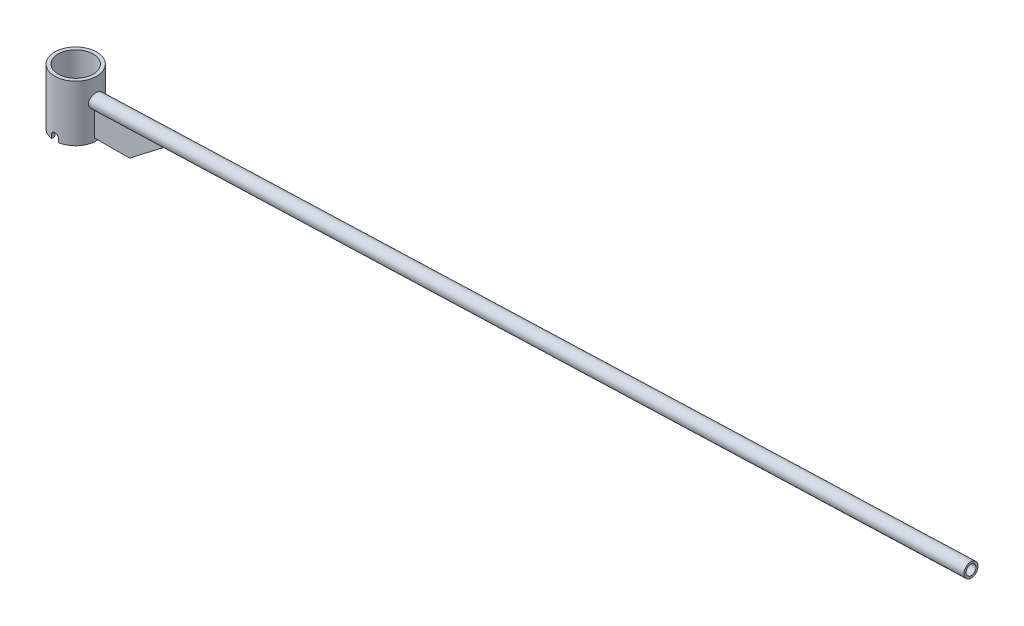
from build123d import *

# Parameters (mm, degrees)
SKETCH_1_R               = 30
SKETCH_1_R_2             = 25
EXTRUDE_1_DEPTH          = 40
EXTRUDE_2_REACH          = 1315.686
EXTRUDE_2_END_RADIUS     = 30
SKETCH_3_R               = 10
SKETCH_3_R_2             = 7
EXTRUDE_3_DEPTH          = 3
CUT_EXTRUDE_1_DEPTH      = 1283.280865753
CUT_EXTRUDE_1_DEPTH_BACK = 1283.280865753


with BuildPart() as part:
    # Эскиз1 → Бобышка-Вытянуть1 (new, symmetric)
    with BuildSketch(Plane(origin=(0, 0, 0), x_dir=(1, 0, 0), z_dir=(0, 1, 0))):
        with Locations(Location((0, 0, 0), (0, 0, 270))):
            Circle(SKETCH_1_R)
        with Locations(Location((0, 0, 0), (0, 0, 270))):
            Circle(SKETCH_1_R_2, mode=Mode.SUBTRACT)
    extrude(amount=EXTRUDE_1_DEPTH, both=True)

    # Эскиз5 → Вырез-Вытянуть1 (cut, two sides: drawn at the far end of the back side and taken through both)
    with BuildSketch(Plane.XY.offset(-CUT_EXTRUDE_1_DEPTH_BACK)):
        with BuildLine():
            Line((-5, -35), (-5, -62))
            Line((-5, -62), (5, -62))
            Line((5, -62), (5, -35))
            ThreePointArc((5, -35), (0, -30), (-5, -35))
        make_face()
    extrude(amount=CUT_EXTRUDE_1_DEPTH + CUT_EXTRUDE_1_DEPTH_BACK, mode=Mode.SUBTRACT)


with BuildPart() as body_2:
    # Бобышка-Вытянуть2: up to this cylinder (the profile starts outside it)
    extrude_2_end = Plane(origin=(0, 43.939724, 0), z_dir=(0, -1, 0)) * Cylinder(EXTRUDE_2_END_RADIUS, 2692.372, mode=Mode.PRIVATE)
    # Эскиз3 → Бобышка-Вытянуть2 (new, up to the surface)
    with BuildSketch(Plane(origin=(1280, 53.650961865, 0), x_dir=(0, 0, -1), z_dir=(0.999390827019096, 0.03489949670249754, 0)), mode=Mode.PRIVATE) as extrude_2_sk1:
        with Locations(Location((0, 0, 0), (0, 0, 90))):
            Circle(SKETCH_3_R)
        with Locations(Location((0, 0, 0), (0, 0, 90))):
            Circle(SKETCH_3_R_2, mode=Mode.SUBTRACT)
    extrude_2_tool1 = extrude(extrude_2_sk1.sketch, amount=-EXTRUDE_2_REACH, mode=Mode.PRIVATE) - extrude_2_end
    add(extrude_2_tool1.solids().sort_by_distance((1280.339124, 43.939724, 0))[0])


with BuildPart() as body_3:
    # Эскиз4 → Бобышка-Вытянуть3 (new, symmetric)
    with BuildSketch(Plane.XY):
        Polygon((30, -35), (30, 0), (130, 3.485981506), (80, -35), align=None)
    extrude(amount=EXTRUDE_3_DEPTH, both=True)


solid = Compound([part.part, body_2.part, body_3.part])
